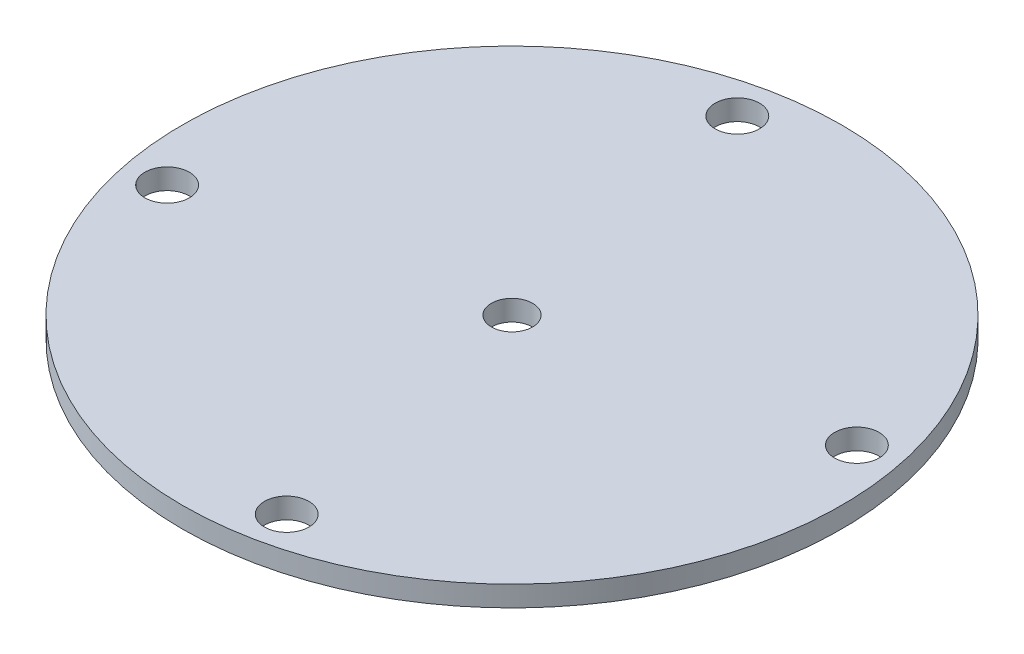
from build123d import *

# Parameters (mm, degrees)
SKETCH1_R           = 50.8
SKETCH1_R_2         = 3.175
BOSS_EXTRUDE1_DEPTH = 3.175
SKETCH2_R           = 3.429
CUT_EXTRUDE1_DEPTH  = 3.175


with BuildPart() as part:
    # Sketch1 → Boss-Extrude1 (new body)
    with BuildSketch(Plane(origin=(0, 0, 0), x_dir=(1, 0, 0), z_dir=(0, 1, 0))):
        with Locations(Location((0, 0, 0), (0, 0, 270))):
            Circle(SKETCH1_R)
        with Locations(Location((0, 0, 0), (0, 0, 270))):
            Circle(SKETCH1_R_2, mode=Mode.SUBTRACT)
    extrude(amount=BOSS_EXTRUDE1_DEPTH)

    # Sketch2 → Cut-Extrude1 (cut)
    with BuildSketch(Plane(origin=(0, 3.175, 0), x_dir=(1, 0, 0), z_dir=(0, 1, 0))):
        with Locations(Location((-9.214642662, 43.945595463, 0), (0, 0, 270))):
            Circle(SKETCH2_R)
        with Locations(Location((-43.945595463, -9.214642662, 0), (0, 0, 270))):
            Circle(SKETCH2_R)
        with Locations(Location((43.945595463, 9.214642662, 0), (0, 0, 270))):
            Circle(SKETCH2_R)
        with Locations(Location((9.214642662, -43.945595463, 0), (0, 0, 270))):
            Circle(SKETCH2_R)
    extrude(amount=-CUT_EXTRUDE1_DEPTH, mode=Mode.SUBTRACT)


solid = part.part
